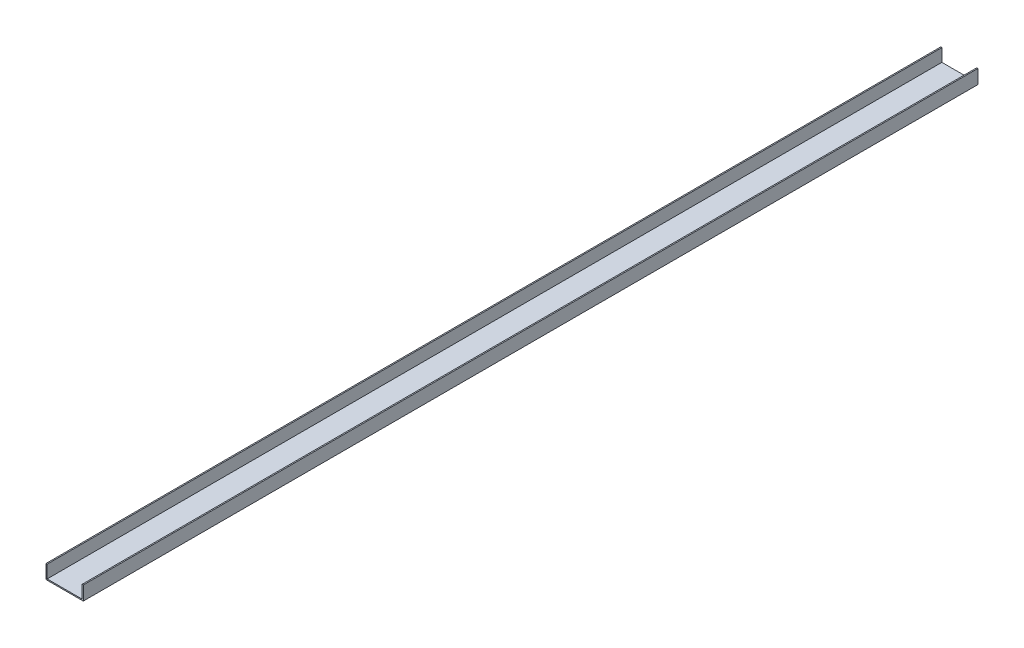
from build123d import *

# Parameters (mm, degrees)
BOSS_EXTRUDE2_DEPTH = 609.6


with BuildPart() as part:
    # Sketch3 → Boss-Extrude2 (new, symmetric)
    with BuildSketch(Plane.XY):
        Polygon((-25.4, 9.525), (-25.4, -9.525), (25.4, -9.525), (25.4, 9.525), (23.8125, 9.525), (23.8125, -7.9375), (-23.8125, -7.9375), (-23.8125, 9.525), align=None)
    extrude(amount=BOSS_EXTRUDE2_DEPTH, both=True)


solid = part.part
